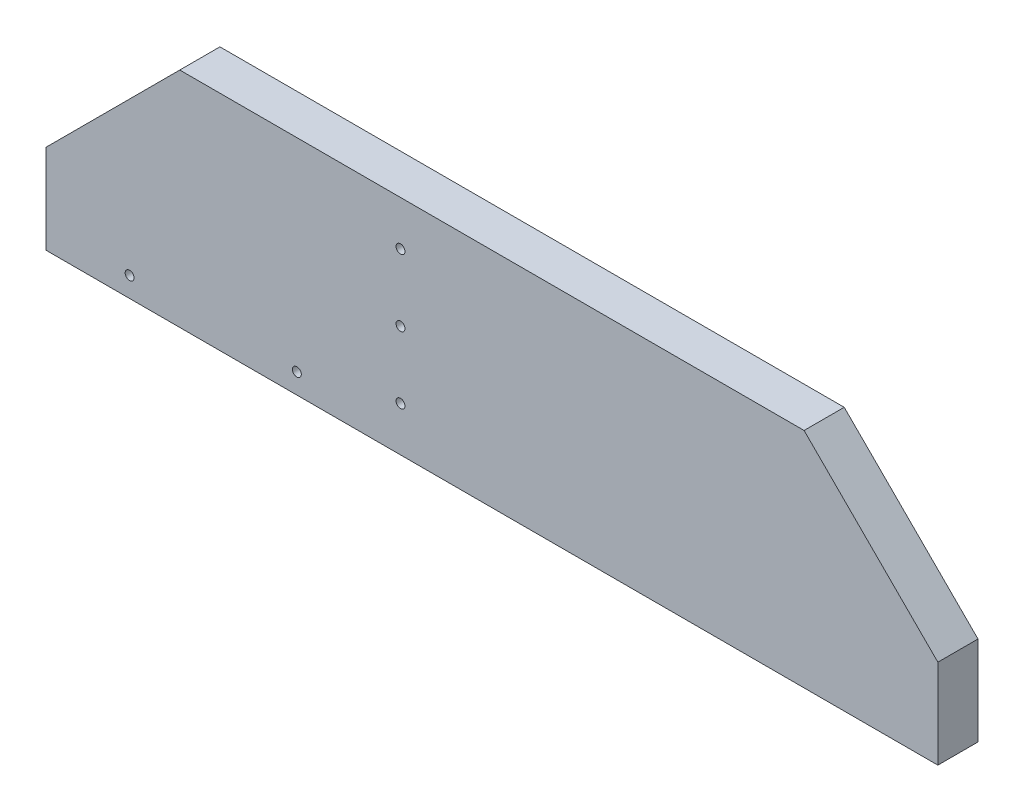
from build123d import *

# Parameters (mm, degrees)
ESBO_O1_W                = 40
ESBO_O1_H                = 10
RESSALTO_EXTRUS_O1_DEPTH = 1.8
CORTE_EXTRUS_O1_DEPTH    = 1.8
ESBO_O4_R                = 0.2
CORTE_EXTRUS_O2_DEPTH    = 1.8
ESBO_O5_R                = 0.2
CORTE_EXTRUS_O3_DEPTH    = 64.032052928


with BuildPart() as part:
    # Esboço1 → Ressalto-extrusão1 (new body)
    with BuildSketch(Plane.XY):
        with Locations((-37.620035336, 20.489825898)):
            Rectangle(ESBO_O1_W, ESBO_O1_H)
    extrude(amount=RESSALTO_EXTRUS_O1_DEPTH)

    # Esboço3 → Corte-extrusão1 (cut)
    with BuildSketch(Plane.XY.offset(1.8)):
        Polygon((-51.620035336, 25.489825898), (-57.620035336, 19.489825898), (-57.620035336, 25.489825898), align=None)
        Polygon((-17.620035336, 19.489825898), (-23.620035336, 25.489825898), (-17.620035336, 25.489825898), align=None)
    extrude(amount=-CORTE_EXTRUS_O1_DEPTH, mode=Mode.SUBTRACT)

    # Esboço4 → Corte-extrusão2 (cut)
    with BuildSketch(Plane.XY.offset(1.8)):
        with Locations((-41.720035336, 17.489825898)):
            Circle(ESBO_O4_R)
        with Locations((-41.720035336, 20.489825898)):
            Circle(ESBO_O4_R)
        with Locations((-41.720035336, 23.489825898)):
            Circle(ESBO_O4_R)
    extrude(amount=-CORTE_EXTRUS_O2_DEPTH, mode=Mode.SUBTRACT)

    # Esboço5 → Corte-extrusão3 (cut, through all)
    with BuildSketch(Plane.XY.offset(1.8)):
        with Locations((-53.870035336, 16.389825898)):
            Circle(ESBO_O5_R)
        with Locations((-46.370035336, 16.389825898)):
            Circle(ESBO_O5_R)
    extrude(amount=-CORTE_EXTRUS_O3_DEPTH, mode=Mode.SUBTRACT)


solid = part.part
